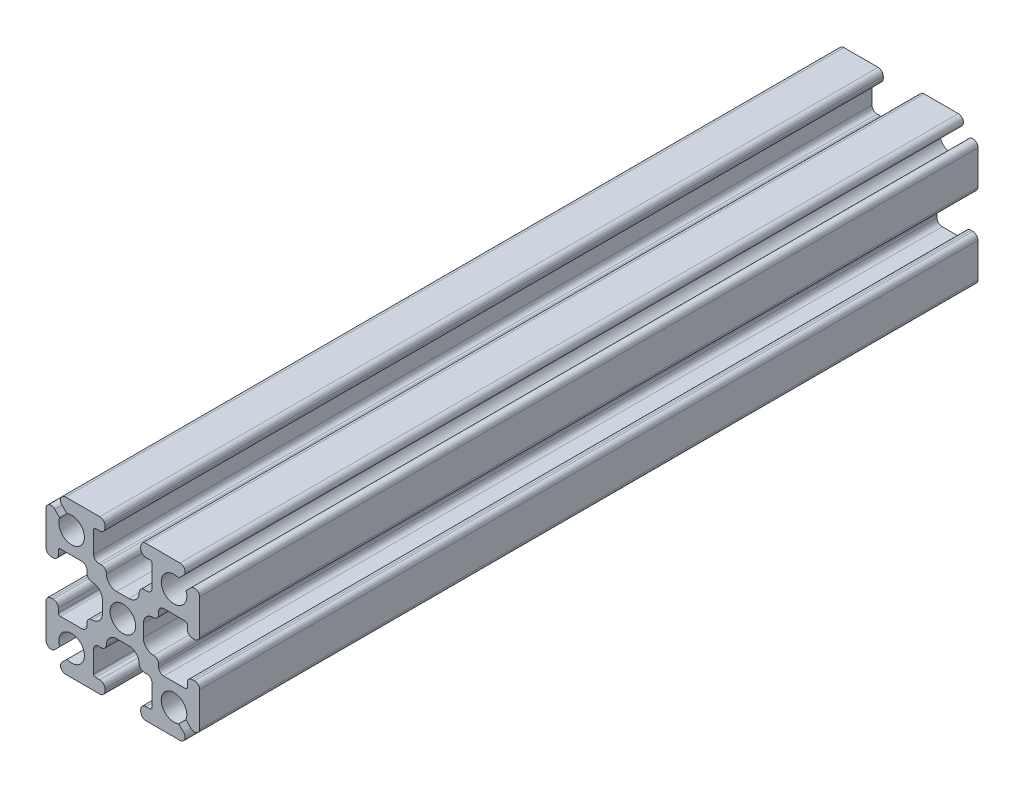
from build123d import *

# Parameters (mm, degrees)
SKETCH1_R           = 1.25
BOSS_EXTRUDE1_DEPTH = 76


with BuildPart() as part:
    # Sketch1 → Boss-Extrude1 (new body)
    with BuildSketch(Plane.XY):
        with BuildLine():
            Line((6.646446609, 5.939339828), (6.163645978, 5.456539197))
            ThreePointArc((6.163645978, 5.456539197), (4.116116524, 4.116116524), (5.456539197, 6.163645978))
            Line((5.456539197, 6.163645978), (5.939339828, 6.646446609))
            ThreePointArc((5.939339828, 6.646446609), (6.047726204, 7.191341716), (5.585786438, 7.5))
            Line((5.585786438, 7.5), (2.25, 7.5))
            ThreePointArc((2.25, 7.5), (1.896446609, 7.353553391), (1.75, 7))
            Line((1.75, 7), (1.75, 6.8))
            ThreePointArc((1.75, 6.8), (1.896446609, 6.446446609), (2.25, 6.3))
            Line((2.25, 6.3), (2.65, 6.3))
            ThreePointArc((2.65, 6.3), (2.791421356, 6.241421356), (2.85, 6.1))
            Line((2.85, 6.1), (2.85, 4))
            ThreePointArc((2.85, 4), (2.703553391, 3.646446609), (2.35, 3.5))
            Line((2.35, 3.5), (2.1, 3.5))
            ThreePointArc((2.1, 3.5), (1.746446609, 3.353553391), (1.6, 3))
            ThreePointArc((1.6, 3), (1.307106781, 2.292893219), (0.6, 2))
            Line((0.6, 2), (-0.6, 2))
            ThreePointArc((-0.6, 2), (-1.307106781, 2.292893219), (-1.6, 3))
            ThreePointArc((-1.6, 3), (-1.746446609, 3.353553391), (-2.1, 3.5))
            Line((-2.1, 3.5), (-2.35, 3.5))
            ThreePointArc((-2.35, 3.5), (-2.703553391, 3.646446609), (-2.85, 4))
            Line((-2.85, 4), (-2.85, 6.1))
            ThreePointArc((-2.85, 6.1), (-2.791421356, 6.241421356), (-2.65, 6.3))
            Line((-2.65, 6.3), (-2.25, 6.3))
            ThreePointArc((-2.25, 6.3), (-1.896446609, 6.446446609), (-1.75, 6.8))
            Line((-1.75, 6.8), (-1.75, 7))
            ThreePointArc((-1.75, 7), (-1.896446609, 7.353553391), (-2.25, 7.5))
            Line((-2.25, 7.5), (-5.585786438, 7.5))
            ThreePointArc((-5.585786438, 7.5), (-6.047726204, 7.191341716), (-5.939339828, 6.646446609))
            Line((-5.939339828, 6.646446609), (-5.456539197, 6.163645978))
            ThreePointArc((-5.456539197, 6.163645978), (-4.116116524, 4.116116524), (-6.163645978, 5.456539197))
            Line((-6.163645978, 5.456539197), (-6.646446609, 5.939339828))
            ThreePointArc((-6.646446609, 5.939339828), (-7.191341716, 6.047726204), (-7.5, 5.585786438))
            Line((-7.5, 5.585786438), (-7.5, 2.25))
            ThreePointArc((-7.5, 2.25), (-7.353553391, 1.896446609), (-7, 1.75))
            Line((-7, 1.75), (-6.8, 1.75))
            ThreePointArc((-6.8, 1.75), (-6.446446609, 1.896446609), (-6.3, 2.25))
            Line((-6.3, 2.25), (-6.3, 2.65))
            ThreePointArc((-6.3, 2.65), (-6.241421356, 2.791421356), (-6.1, 2.85))
            Line((-6.1, 2.85), (-4, 2.85))
            ThreePointArc((-4, 2.85), (-3.646446609, 2.703553391), (-3.5, 2.35))
            Line((-3.5, 2.35), (-3.5, 2.1))
            ThreePointArc((-3.5, 2.1), (-3.353553391, 1.746446609), (-3, 1.6))
            ThreePointArc((-3, 1.6), (-2.292893219, 1.307106781), (-2, 0.6))
            Line((-2, 0.6), (-2, -0.6))
            ThreePointArc((-2, -0.6), (-2.292893219, -1.307106781), (-3, -1.6))
            ThreePointArc((-3, -1.6), (-3.353553391, -1.746446609), (-3.5, -2.1))
            Line((-3.5, -2.1), (-3.5, -2.35))
            ThreePointArc((-3.5, -2.35), (-3.646446609, -2.703553391), (-4, -2.85))
            Line((-4, -2.85), (-6.1, -2.85))
            ThreePointArc((-6.1, -2.85), (-6.241421356, -2.791421356), (-6.3, -2.65))
            Line((-6.3, -2.65), (-6.3, -2.25))
            ThreePointArc((-6.3, -2.25), (-6.446446609, -1.896446609), (-6.8, -1.75))
            Line((-6.8, -1.75), (-7, -1.75))
            ThreePointArc((-7, -1.75), (-7.353553391, -1.896446609), (-7.5, -2.25))
            Line((-7.5, -2.25), (-7.5, -5.585786438))
            ThreePointArc((-7.5, -5.585786438), (-7.191341716, -6.047726204), (-6.646446609, -5.939339828))
            Line((-6.646446609, -5.939339828), (-6.163645978, -5.456539197))
            ThreePointArc((-6.163645978, -5.456539197), (-4.116116524, -4.116116524), (-5.456539197, -6.163645978))
            Line((-5.456539197, -6.163645978), (-5.939339828, -6.646446609))
            ThreePointArc((-5.939339828, -6.646446609), (-6.047726204, -7.191341716), (-5.585786438, -7.5))
            Line((-5.585786438, -7.5), (-2.25, -7.5))
            ThreePointArc((-2.25, -7.5), (-1.896446609, -7.353553391), (-1.75, -7))
            Line((-1.75, -7), (-1.75, -6.8))
            ThreePointArc((-1.75, -6.8), (-1.896446609, -6.446446609), (-2.25, -6.3))
            Line((-2.25, -6.3), (-2.65, -6.3))
            ThreePointArc((-2.65, -6.3), (-2.791421356, -6.241421356), (-2.85, -6.1))
            Line((-2.85, -6.1), (-2.85, -4))
            ThreePointArc((-2.85, -4), (-2.703553391, -3.646446609), (-2.35, -3.5))
            Line((-2.35, -3.5), (-2.1, -3.5))
            ThreePointArc((-2.1, -3.5), (-1.746446609, -3.353553391), (-1.6, -3))
            ThreePointArc((-1.6, -3), (-1.307106781, -2.292893219), (-0.6, -2))
            Line((-0.6, -2), (0.6, -2))
            ThreePointArc((0.6, -2), (1.307106781, -2.292893219), (1.6, -3))
            ThreePointArc((1.6, -3), (1.746446609, -3.353553391), (2.1, -3.5))
            Line((2.1, -3.5), (2.35, -3.5))
            ThreePointArc((2.35, -3.5), (2.703553391, -3.646446609), (2.85, -4))
            Line((2.85, -4), (2.85, -6.1))
            ThreePointArc((2.85, -6.1), (2.791421356, -6.241421356), (2.65, -6.3))
            Line((2.65, -6.3), (2.25, -6.3))
            ThreePointArc((2.25, -6.3), (1.896446609, -6.446446609), (1.75, -6.8))
            Line((1.75, -6.8), (1.75, -7))
            ThreePointArc((1.75, -7), (1.896446609, -7.353553391), (2.25, -7.5))
            Line((2.25, -7.5), (5.585786438, -7.5))
            ThreePointArc((5.585786438, -7.5), (6.047726204, -7.191341716), (5.939339828, -6.646446609))
            Line((5.939339828, -6.646446609), (5.456539197, -6.163645978))
            ThreePointArc((5.456539197, -6.163645978), (4.116116524, -4.116116524), (6.163645978, -5.456539197))
            Line((6.163645978, -5.456539197), (6.646446609, -5.939339828))
            ThreePointArc((6.646446609, -5.939339828), (7.191341716, -6.047726204), (7.5, -5.585786438))
            Line((7.5, -5.585786438), (7.5, -2.25))
            ThreePointArc((7.5, -2.25), (7.353553391, -1.896446609), (7, -1.75))
            Line((7, -1.75), (6.8, -1.75))
            ThreePointArc((6.8, -1.75), (6.446446609, -1.896446609), (6.3, -2.25))
            Line((6.3, -2.25), (6.3, -2.65))
            ThreePointArc((6.3, -2.65), (6.241421356, -2.791421356), (6.1, -2.85))
            Line((6.1, -2.85), (4, -2.85))
            ThreePointArc((4, -2.85), (3.646446609, -2.703553391), (3.5, -2.35))
            Line((3.5, -2.35), (3.5, -2.1))
            ThreePointArc((3.5, -2.1), (3.353553391, -1.746446609), (3, -1.6))
            ThreePointArc((3, -1.6), (2.292893219, -1.307106781), (2, -0.6))
            Line((2, -0.6), (2, 0.6))
            ThreePointArc((2, 0.6), (2.292893219, 1.307106781), (3, 1.6))
            ThreePointArc((3, 1.6), (3.353553391, 1.746446609), (3.5, 2.1))
            Line((3.5, 2.1), (3.5, 2.35))
            ThreePointArc((3.5, 2.35), (3.646446609, 2.703553391), (4, 2.85))
            Line((4, 2.85), (6.1, 2.85))
            ThreePointArc((6.1, 2.85), (6.241421356, 2.791421356), (6.3, 2.65))
            Line((6.3, 2.65), (6.3, 2.25))
            ThreePointArc((6.3, 2.25), (6.446446609, 1.896446609), (6.8, 1.75))
            Line((6.8, 1.75), (7, 1.75))
            ThreePointArc((7, 1.75), (7.353553391, 1.896446609), (7.5, 2.25))
            Line((7.5, 2.25), (7.5, 5.585786438))
            ThreePointArc((7.5, 5.585786438), (7.191341716, 6.047726204), (6.646446609, 5.939339828))
        make_face()
        with Locations(Location((0, 0, 0), (0, 0, 180))):
            Circle(SKETCH1_R, mode=Mode.SUBTRACT)
    extrude(amount=BOSS_EXTRUDE1_DEPTH)


solid = part.part
